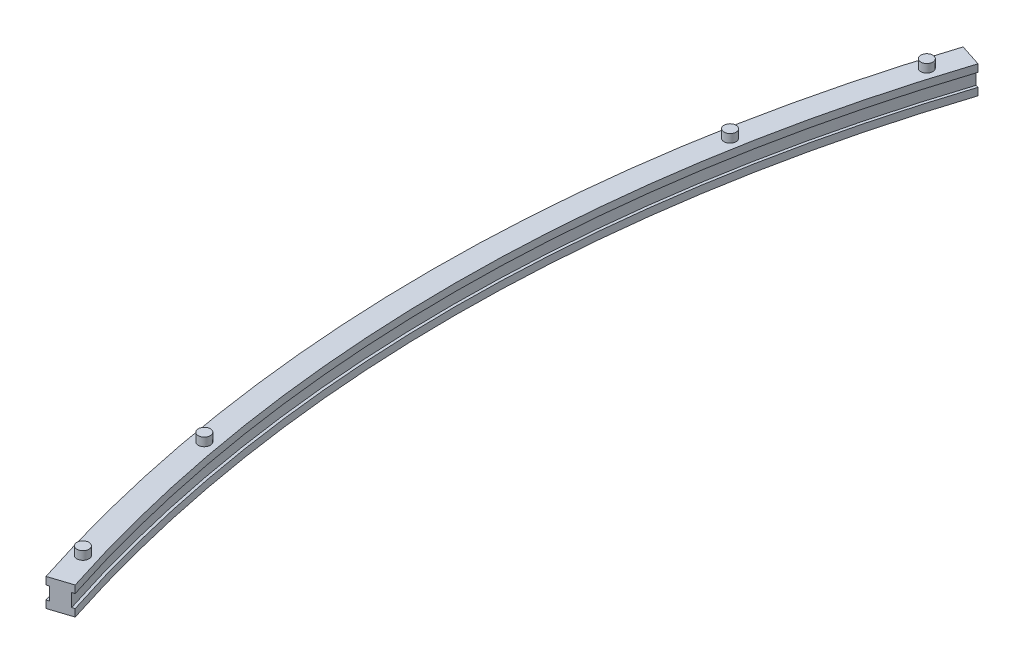
from build123d import *

# Parameters (mm, degrees)
BOSS_EXTRUDE1_DEPTH = 0.8
BOSS_EXTRUDE2_DEPTH = 1.4
BOSS_EXTRUDE3_DEPTH = 0.8
SKETCH1_3_R         = 0.65
BOSS_EXTRUDE4_DEPTH = 3.9


with BuildPart() as part:
    # Sketch1 → Boss-Extrude1 (new body)
    with BuildSketch(Plane(origin=(0, 0, 0), x_dir=(1, 0, 0), z_dir=(0, 1, 0))):
        with BuildLine():
            Line((-152.269601857, -49.475392781), (-149.891960567, -48.702850295))
            ThreePointArc((-149.891960567, -48.702850295), (-157.605734253, 0), (-149.891960567, 48.702850295))
            Line((-149.891960567, 48.702850295), (-152.269601857, 49.475392781))
            ThreePointArc((-152.269601857, 49.475392781), (-160.105734253, 0), (-152.269601857, -49.475392781))
        make_face()
    extrude(amount=BOSS_EXTRUDE1_DEPTH)

    # Sketch2 → Boss-Extrude2 (add)
    with BuildSketch(Plane(origin=(0, 0.8, 0), x_dir=(1, 0, 0), z_dir=(0, 1, 0))):
        with BuildLine():
            Line((-150.177277522, -48.795555393), (-151.984284902, -49.382687683))
            ThreePointArc((-151.984284902, -49.382687683), (-159.805734253, 0), (-151.984284902, 49.382687683))
            Line((-151.984284902, 49.382687683), (-150.177277522, 48.795555393))
            ThreePointArc((-150.177277522, 48.795555393), (-157.905734253, 0), (-150.177277522, -48.795555393))
        make_face()
    extrude(amount=BOSS_EXTRUDE2_DEPTH)

    # Sketch3 → Boss-Extrude3 (add)
    with BuildSketch(Plane(origin=(0, 2.2, 0), x_dir=(1, 0, 0), z_dir=(0, 1, 0))):
        with BuildLine():
            Line((-152.269601857, -49.475392781), (-149.891960567, -48.702850295))
            ThreePointArc((-149.891960567, -48.702850295), (-157.605734253, 0), (-149.891960567, 48.702850295))
            Line((-149.891960567, 48.702850295), (-152.269601857, 49.475392781))
            ThreePointArc((-152.269601857, 49.475392781), (-160.105734253, 0), (-152.269601857, -49.475392781))
        make_face()
    extrude(amount=BOSS_EXTRUDE3_DEPTH)

    # Sketch1<3> → Boss-Extrude4 (add)
    with BuildSketch(Plane(origin=(0, 0, 0), x_dir=(1, 0, 0), z_dir=(0, 1, 0))):
        with Locations((-156.303, -28.364)):
            Circle(SKETCH1_3_R)
        with Locations((-156.303, 28.364)):
            Circle(SKETCH1_3_R)
        with Locations((-152.239, 45.522)):
            Circle(SKETCH1_3_R)
        with Locations((-152.239, -45.522)):
            Circle(SKETCH1_3_R)
    extrude(amount=BOSS_EXTRUDE4_DEPTH)


solid = part.part
